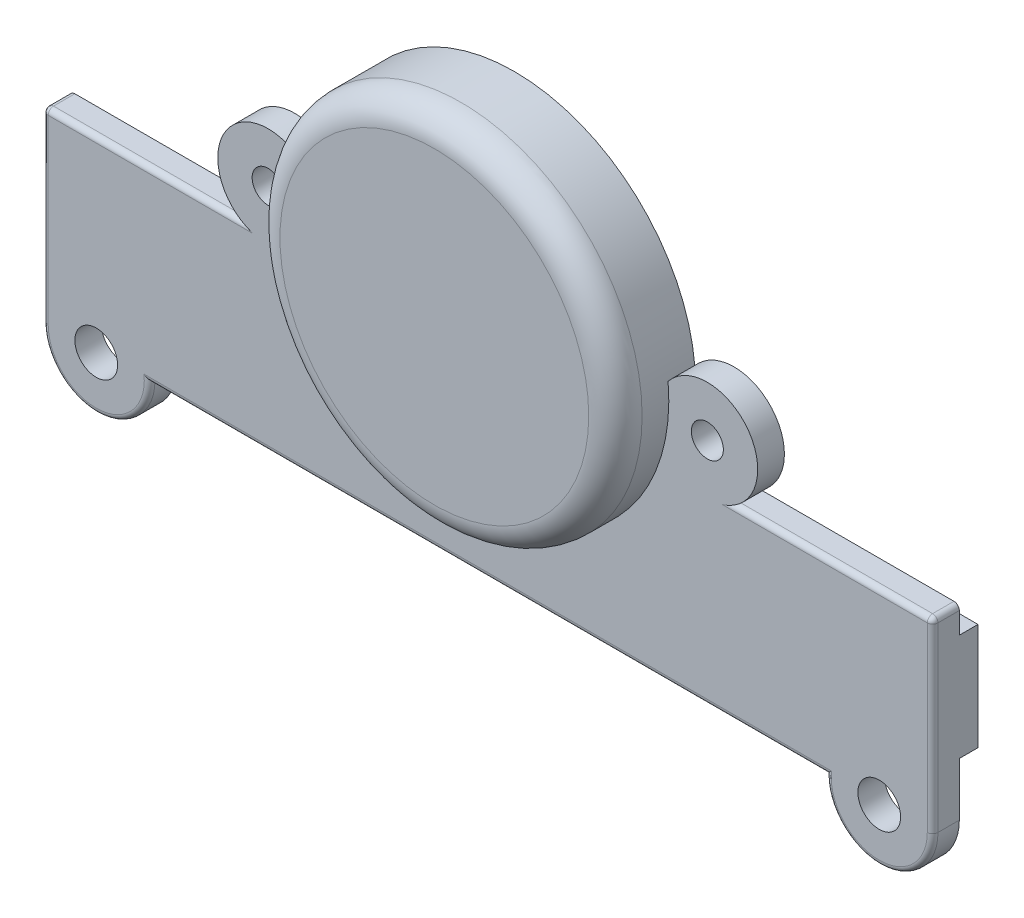
from build123d import *

# Parameters (mm, degrees)
SKETCH1_R           = 4
SKETCH1_R_2         = 3
SKETCH1_R_3         = 14
BOSS_EXTRUDE2_DEPTH = 5
SKETCH2_R           = 33.920814748
BOSS_EXTRUDE3_DEPTH = 10
BOSS_EXTRUDE4_DEPTH = 3.5
SKETCH5_R           = 14
CUT_EXTRUDE1_DEPTH  = 2
FILLET1_R           = 5
SKETCH6_R           = 12
CUT_EXTRUDE2_DEPTH  = 5
FILLET2_R           = 1


with BuildPart() as part:
    # Sketch1 → Boss-Extrude2 (new body)
    with BuildSketch(Plane.XY):
        with BuildLine():
            Line((-83.333333333, -10.859226218), (-83.333333333, -35.859226218))
            Line((-83.333333333, -35.859226218), (-83.333333333, -45.859226218))
            ThreePointArc((-83.333333333, -45.859226218), (-73.333333333, -55.859226218), (-63.333333333, -45.859226218))
            Line((-63.333333333, -45.859226218), (0, -45.859226218))
            Line((0, -45.859226218), (63.333333333, -45.859226218))
            ThreePointArc((63.333333333, -45.859226218), (73.333333333, -55.859226218), (83.333333333, -45.859226218))
            Line((83.333333333, -45.859226218), (83.333333333, -35.859226218))
            Line((83.333333333, -35.859226218), (83.333333333, -10.859226218))
            Line((83.333333333, -10.859226218), (46.135632545, -10.859226218))
            ThreePointArc((46.135632545, -10.859226218), (48.189979587, 3.404653395), (33.783237398, 3.051973795))
            ThreePointArc((33.783237398, 3.051973795), (0, 33.920814748), (-33.783237398, 3.051973795))
            ThreePointArc((-33.783237398, 3.051973795), (-48.189979587, 3.404653395), (-46.135632545, -10.859226218))
            Line((-46.135632545, -10.859226218), (-83.333333333, -10.859226218))
        make_face()
        with Locations((-73.333333333, -45.859226218)):
            Circle(SKETCH1_R, mode=Mode.SUBTRACT)
        with Locations((73.333333333, -45.859226218)):
            Circle(SKETCH1_R, mode=Mode.SUBTRACT)
        with Locations((-41.135632545, -2.859226218)):
            Circle(SKETCH1_R_2, mode=Mode.SUBTRACT)
        Circle(SKETCH1_R_3, mode=Mode.SUBTRACT)
        with Locations((41.135632545, -2.859226218)):
            Circle(SKETCH1_R_2, mode=Mode.SUBTRACT)
    extrude(amount=BOSS_EXTRUDE2_DEPTH)

    # Sketch2 → Boss-Extrude3 (add)
    with BuildSketch(Plane.XY.offset(5)):
        with Locations(Location((0, 0, 0), (0, 0, 174.837918502))):
            Circle(SKETCH2_R)
    extrude(amount=BOSS_EXTRUDE3_DEPTH)

    # Sketch3 → Boss-Extrude4 (add)
    with BuildSketch(Plane(origin=(0, 0, 0), x_dir=(-1, 0, 0), z_dir=(0, 0, -1))):
        Polygon((-83.333333333, -35.859226218), (83.333333333, -35.859226218), (83.333333333, -15.859226218), (-5.229680356, -15.859226218), (-83.333333333, -15.859226218), align=None)
    extrude(amount=BOSS_EXTRUDE4_DEPTH)

    # Sketch5 → Cut-Extrude1 (cut)
    with BuildSketch(Plane(origin=(0, 0, 5), x_dir=(-1, 0, 0), z_dir=(0, 0, -1))):
        Circle(SKETCH5_R)
    extrude(amount=-CUT_EXTRUDE1_DEPTH, mode=Mode.SUBTRACT)

    # Fillet1
    fillet1_edges = [part.edges().sort_by_distance(p)[0] for p in [
        (33.783237398, -3.051973795, 15),
    ]]
    fillet(fillet1_edges, radius=FILLET1_R)

    # Sketch6 → Cut-Extrude2 (cut)
    with BuildSketch(Plane(origin=(0, 0, 7), x_dir=(-1, 0, 0), z_dir=(0, 0, -1))):
        Circle(SKETCH6_R)
    extrude(amount=-CUT_EXTRUDE2_DEPTH, mode=Mode.SUBTRACT)

    # Fillet2
    fillet2_edges = [part.edges().sort_by_distance(p)[0] for p in [
        (83.333333333, -10.859226218, 2.5),
        (-83.333333333, -10.859226218, 2.5),
        (64.734482939, -10.859226218, 5),
        (-64.734482939, -10.859226218, 5),
        (-83.333333333, -28.359226218, 5),
        (-73.333333333, -55.859226218, 5),
        (0, -45.859226218, 5),
        (73.333333333, -55.859226218, 5),
        (83.333333333, -28.359226218, 5),
    ]]
    fillet(fillet2_edges, radius=FILLET2_R)


solid = part.part
